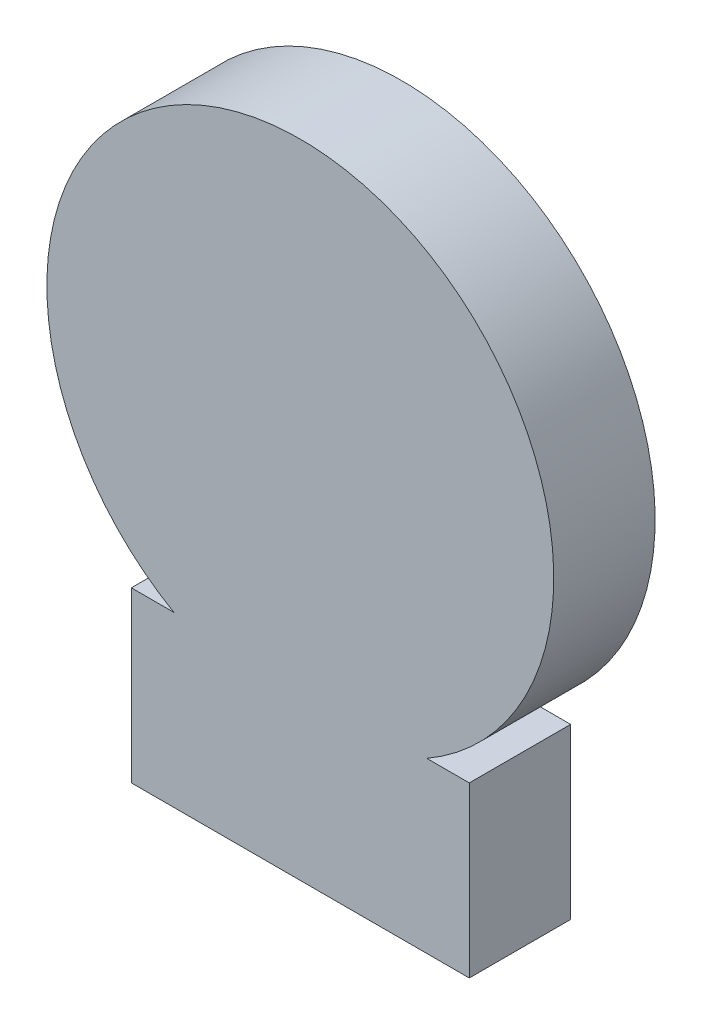
from build123d import *

# Parameters (mm, degrees)
ESQUISSE1_W        = 20
ESQUISSE1_H        = 10
BOSS_EXTRU_1_DEPTH = 6
ESQUISSE2_R        = 15
BOSS_EXTRU_2_DEPTH = 6


with BuildPart() as part:
    # Esquisse1 → Boss.-Extru.1 (new body)
    with BuildSketch(Plane.XY):
        Rectangle(ESQUISSE1_W, ESQUISSE1_H)
    extrude(amount=BOSS_EXTRU_1_DEPTH)

    # Esquisse2 → Boss.-Extru.2 (add)
    with BuildSketch(Plane.XY.offset(6)):
        with Locations((0, 18)):
            Circle(ESQUISSE2_R)
    extrude(amount=-BOSS_EXTRU_2_DEPTH)


solid = part.part
